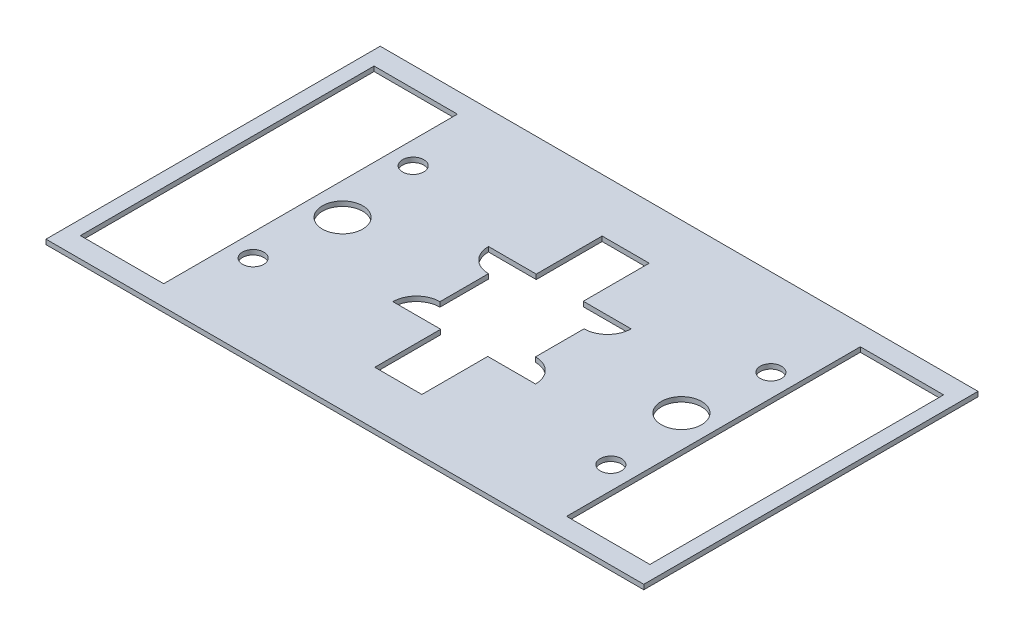
from build123d import *

# Parameters (mm, degrees)
SKETCH1_W           = 63.5
SKETCH1_H           = 35.5
SKETCH1_R           = 1.13
SKETCH1_W_2         = 8.85
SKETCH1_H_2         = 31.2
SKETCH1_R_2         = 2.144603346
BOSS_EXTRUDE1_DEPTH = 0.508


with BuildPart() as part:
    # Sketch1 → Boss-Extrude1 (new body)
    with BuildSketch(Plane(origin=(0, 0, 0), x_dir=(1, 0, 0), z_dir=(0, 1, 0))):
        Rectangle(SKETCH1_W, SKETCH1_H)
        with BuildLine():
            Line((-2.5, 5.075), (-2.5, 12.075))
            Line((-2.5, 12.075), (2.5, 12.075))
            Line((2.5, 12.075), (2.5, 5.075))
            Line((2.5, 5.075), (7.575, 5.075))
            ThreePointArc((7.575, 5.075), (6.842766953, 3.307233047), (5.075, 2.575))
            Line((5.075, 2.575), (5.075, -2.575))
            ThreePointArc((5.075, -2.575), (6.842766953, -3.307233047), (7.575, -5.075))
            Line((7.575, -5.075), (2.5, -5.075))
            Line((2.5, -5.075), (2.5, -12.075))
            Line((2.5, -12.075), (-2.5, -12.075))
            Line((-2.5, -12.075), (-2.5, -5.075))
            Line((-2.5, -5.075), (-7.575, -5.075))
            ThreePointArc((-7.575, -5.075), (-6.842766953, -3.307233047), (-5.075, -2.575))
            Line((-5.075, -2.575), (-5.075, 2.575))
            ThreePointArc((-5.075, 2.575), (-6.842766953, 3.307233047), (-7.575, 5.075))
            Line((-7.575, 5.075), (-2.5, 5.075))
        make_face(mode=Mode.SUBTRACT)
        with Locations(Location((-19, -8.5, 0), (0, 0, 270))):
            Circle(SKETCH1_R, mode=Mode.SUBTRACT)
        with Locations(Location((19, -8.5, 0), (0, 0, 270))):
            Circle(SKETCH1_R, mode=Mode.SUBTRACT)
        with Locations((-25.825, 0)):
            Rectangle(SKETCH1_W_2, SKETCH1_H_2, mode=Mode.SUBTRACT)
        with Locations(Location((-18, 0, 0), (0, 0, 270))):
            Circle(SKETCH1_R_2, mode=Mode.SUBTRACT)
        with Locations(Location((-19, 8.5, 0), (0, 0, 270))):
            Circle(SKETCH1_R, mode=Mode.SUBTRACT)
        with Locations(Location((19, 8.5, 0), (0, 0, 270))):
            Circle(SKETCH1_R, mode=Mode.SUBTRACT)
        with Locations((25.825, 0)):
            Rectangle(SKETCH1_W_2, SKETCH1_H_2, mode=Mode.SUBTRACT)
        with Locations(Location((18, 0, 0), (0, 0, 270))):
            Circle(SKETCH1_R_2, mode=Mode.SUBTRACT)
    extrude(amount=BOSS_EXTRUDE1_DEPTH)


solid = part.part
